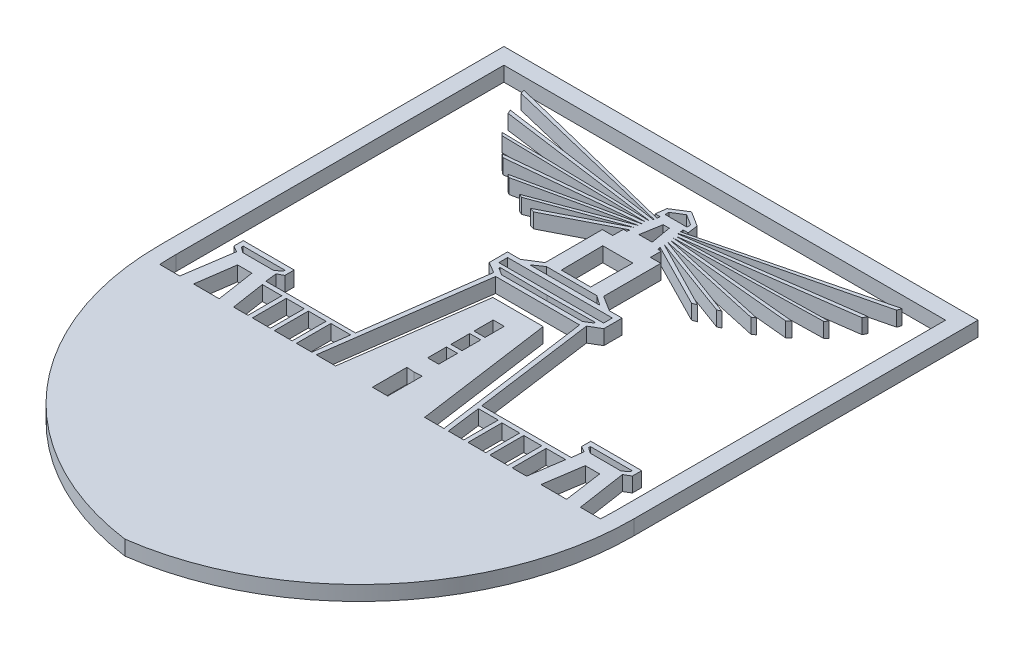
from build123d import *

# Parameters (mm, degrees)
BOSS_EXTRUDE1_DEPTH   = 5
SKETCH1_W             = 35.518676742
SKETCH1_H             = 2.973384896
BOSS_EXTRUDE1_2_DEPTH = 5
SKETCH2_W             = 3.739601515
SKETCH2_H             = 6.383712989
SKETCH2_H_2           = 6.353683651
SKETCH2_H_3           = 6.508205925
BOSS_EXTRUDE2_DEPTH   = 5
BOSS_EXTRUDE3_DEPTH   = 5
BOSS_EXTRUDE4_DEPTH   = 5
SCALE1_SCALE          = 0.1


with BuildPart() as part:
    # Sketch1 → Boss-Extrude1 (new body)
    with BuildSketch(Plane(origin=(0, 0, 0), x_dir=(1, 0, 0), z_dir=(0, 1, 0))):
        with BuildLine():
            Line((499.015386316, 207.28700306), (338.281970651, 207.28700306))
            Line((338.281970651, 207.28700306), (338.281970651, 90.599107334))
            ThreePointArc((338.281970651, 90.599107334), (361.193423149, 29.441083115), (418.648678484, -1.609395405))
            ThreePointArc((418.648678484, -1.609395405), (476.103933818, 29.441083115), (499.015386316, 90.599107334))
            Line((499.015386316, 90.599107334), (499.015386316, 207.28700306))
        make_face()
        with BuildLine():
            Line((343.781970651, 90.599107334), (343.781970651, 201.78700306))
            Line((343.781970651, 201.78700306), (493.515386316, 201.78700306))
            Line((493.515386316, 201.78700306), (493.515386316, 90.599107334))
            ThreePointArc((493.515386316, 90.599107334), (472.206406244, 33.341374895), (418.648678484, 3.945961086))
            ThreePointArc((418.648678484, 3.945961086), (365.090950724, 33.341374895), (343.781970651, 90.599107334))
        make_face(mode=Mode.SUBTRACT)
    extrude(amount=BOSS_EXTRUDE1_DEPTH)



with BuildPart() as body_2:
    # Sketch1 → Boss-Extrude1 2 (new body)
    with BuildSketch(Plane(origin=(0, 0, 0), x_dir=(1, 0, 0), z_dir=(0, 1, 0))):
        Polygon((353.23455517, 101.675927281), (350.738896881, 84.942719756), (355.417689582, 84.942719756), (357.264447955, 98.002828752), (362.135044816, 98.002828752), (364.099681383, 84.942719756), (368.987041325, 84.942719756), (367.231310974, 96.439388257), (373.837859574, 96.439388257), (373.837859574, 84.942719756), (375.355580199, 84.942719756), (375.355580199, 96.439388257), (381.426462696, 96.439388257), (381.426462696, 84.942719756), (382.828735959, 84.942719756), (382.828735959, 96.446308535), (388.833613863, 96.446308535), (388.833613863, 84.942719756), (390.287060962, 84.942719756), (390.287060962, 96.624281649), (396.990714929, 96.624281649), (395.490984865, 84.942719756), (397.004815256, 84.942719756), (404.418616695, 138.352897543), (432.878740273, 138.352897543), (440.292541712, 84.942719756), (441.806372102, 84.942719756), (440.306642039, 96.624281649), (447.010296005, 96.624281649), (447.010296005, 84.942719756), (448.463743104, 84.942719756), (448.463743104, 96.446308535), (454.468621009, 96.446308535), (454.468621009, 84.942719756), (455.870894271, 84.942719756), (455.870894271, 96.439388257), (461.941776769, 96.439388257), (461.941776769, 84.942719756), (463.459497393, 84.942719756), (463.459497393, 96.439388257), (470.066045994, 96.439388257), (468.310315643, 84.942719756), (473.197675585, 84.942719756), (475.162312152, 98.002828752), (480.032909012, 98.002828752), (481.879667385, 84.942719756), (486.558460086, 84.942719756), (484.062801798, 101.675927281), (486.185824147, 102.930917923), (486.185824147, 106.101217326), (468.921817497, 106.101217326), (468.921817497, 102.930917923), (470.867941883, 101.895077524), (470.428494441, 98.002828752), (440.032361858, 98.002828752), (434.384134717, 139.177860038), (438.076888091, 141.360772021), (438.076888091, 147.561454029), (433.753789304, 147.561454029), (428.558805271, 150.823952663), (428.558805271, 170.198874291), (425.044727948, 170.198874291), (425.044727948, 173.828422437), (423.898554849, 173.828422437), (422.531219868, 183.796162618), (424.232281602, 183.796162618), (423.747476116, 187.330347868), (418.648678484, 190.532440542), (413.549880851, 187.330347868), (413.065075365, 183.796162618), (414.766137099, 183.796162618), (413.398802118, 173.828422437), (412.25262902, 173.828422437), (412.25262902, 170.198874291), (408.738551696, 170.198874291), (408.738551696, 150.823952663), (403.543567664, 147.561454029), (399.220468877, 147.561454029), (399.220468877, 141.360772021), (402.913222251, 139.177860038), (397.264995109, 98.002828752), (366.868862526, 98.002828752), (366.429415084, 101.895077524), (368.37553947, 102.930917923), (368.37553947, 106.101217326), (351.11153282, 106.101217326), (351.11153282, 102.930917923), align=None)
        Polygon((352.719031226, 103.848973153), (352.719031226, 104.466751566), (366.868862526, 104.466751566), (366.868862526, 103.848973153), (364.951043808, 102.489860644), (354.531181238, 102.489860644), align=None, mode=Mode.SUBTRACT)
        Polygon((402.507764803, 141.360772021), (402.507764803, 141.761563215), (418.648678484, 141.561581718), (434.789592165, 141.761563215), (434.789592165, 141.360772021), (432.343136238, 139.842036257), (404.95422073, 139.842036257), align=None, mode=Mode.SUBTRACT)
        Polygon((413.549880851, 165.534782704), (423.747476116, 165.534782704), (423.613653185, 151.35799333), (413.683703782, 151.35799333), align=None, mode=Mode.SUBTRACT)
        Polygon((417.607907092, 181.955695622), (419.689449876, 181.955695622), (420.887749618, 174.940974904), (416.409607349, 174.940974904), align=None, mode=Mode.SUBTRACT)
        Polygon((422.364759796, 186.534892149), (422.364759796, 185.272106216), (414.932597172, 185.272106216), (414.932597172, 186.534892149), (418.648678484, 188.849041112), align=None, mode=Mode.SUBTRACT)
        with Locations((418.648678484, 144.452664735)):
            Rectangle(SKETCH1_W, SKETCH1_H, mode=Mode.SUBTRACT)
        Polygon((430.488708921, 147.561454029), (406.808648046, 147.561454029), (410.103669831, 149.872793357), (427.193687136, 149.872793357), align=None, mode=Mode.SUBTRACT)
        Polygon((484.578325742, 104.466751566), (484.578325742, 103.848973153), (482.76617573, 102.489860644), (472.34631316, 102.489860644), (470.428494441, 103.848973153), (470.428494441, 104.466751566), align=None, mode=Mode.SUBTRACT)
    extrude(amount=BOSS_EXTRUDE1_2_DEPTH)


with BuildPart() as part_1:
    add(part.part)

    add(body_2.part)  # Boss-Extrude2 merges body 2
    # Sketch2 → Boss-Extrude2 (add)
    with BuildSketch(Plane(origin=(0, 0, 0), x_dir=(1, 0, 0), z_dir=(0, 1, 0))):
        with BuildLine():
            Line((433.739572607, 84.942719756), (427.193687136, 131.7142907))
            Line((427.193687136, 131.7142907), (410.103669831, 131.7142907))
            Line((410.103669831, 131.7142907), (403.557784361, 84.942719756))
            Line((403.557784361, 84.942719756), (343.964819557, 84.942719756))
            ThreePointArc((343.964819557, 84.942719756), (366.975502319, 31.230073277), (418.648678484, 3.945961086))
            ThreePointArc((418.648678484, 3.945961086), (470.321854648, 31.230073277), (493.332537411, 84.942719756))
            Line((493.332537411, 84.942719756), (433.739572607, 84.942719756))
        make_face()
        Polygon((421.241016164, 84.942719756), (416.056340804, 84.942719756), (416.056340804, 96.624281649), (418.648678484, 96.446308535), (421.241016164, 96.624281649), align=None, mode=Mode.SUBTRACT)
        with Locations((418.648678484, 106.122774418)):
            Rectangle(SKETCH2_W, SKETCH2_H, mode=Mode.SUBTRACT)
        with Locations((418.648678484, 114.031908878)):
            Rectangle(SKETCH2_W, SKETCH2_H_2, mode=Mode.SUBTRACT)
        with Locations((418.648678484, 121.909851486)):
            Rectangle(SKETCH2_W, SKETCH2_H_3, mode=Mode.SUBTRACT)
    extrude(amount=BOSS_EXTRUDE2_DEPTH)

    # Sketch3 → Boss-Extrude3 (add)
    with BuildSketch(Plane(origin=(0, 0, 0), x_dir=(1, 0, 0), z_dir=(0, 1, 0))):
        Polygon((354.992902211, 196.424457037), (414.513669152, 181.955695622), (414.630808717, 182.809631754), (354.531181238, 197.834825932), align=None)
    boss_extrude3 = extrude(amount=BOSS_EXTRUDE3_DEPTH)

    # Sketch4 → Boss-Extrude4 (add)
    with BuildSketch(Plane(origin=(0, 0, 0), x_dir=(1, 0, 0), z_dir=(0, 1, 0))):
        Polygon((414.343016845, 180.711656762), (414.484763853, 181.744978778), (358.019309416, 189.684966757), (358.648767654, 188.351572509), align=None)
        Polygon((413.5289994, 174.777548071), (413.740786795, 176.321457755), (390.287060962, 164.233502774), (391.865216647, 163.728828953), align=None)
        Polygon((413.740786795, 176.321457755), (413.916623146, 177.603287804), (384.371519011, 166.540250159), (385.568670801, 165.99538802), align=None)
        Polygon((413.916623146, 177.603287804), (414.058304166, 178.636128778), (376.471829755, 170.414515772), (377.65258503, 169.658163361), align=None)
        Polygon((414.058304166, 178.636128778), (414.212689714, 179.761584539), (369.517743579, 175.470558841), (370.72388837, 174.475723455), align=None)
        Polygon((414.212689714, 179.761584539), (414.343016845, 180.711656762), (363.202063155, 181.744978778), (364.135137981, 180.773420124), align=None)
    boss_extrude4 = extrude(amount=BOSS_EXTRUDE4_DEPTH)

    # Mirror1: Boss-Extrude3, Boss-Extrude4 across plane
    add(boss_extrude3.mirror(Plane.ZY.offset(-418.648678484)))
    add(boss_extrude4.mirror(Plane.ZY.offset(-418.648678484)))


with BuildPart() as part_2:
    # Scale1: scaled about (418.648678484, 2.5, -81.969336348)
    add(part_1.part.scale(SCALE1_SCALE).moved(Location((376.783810636, 2.25, -73.772402713))))


solid = part_2.part
